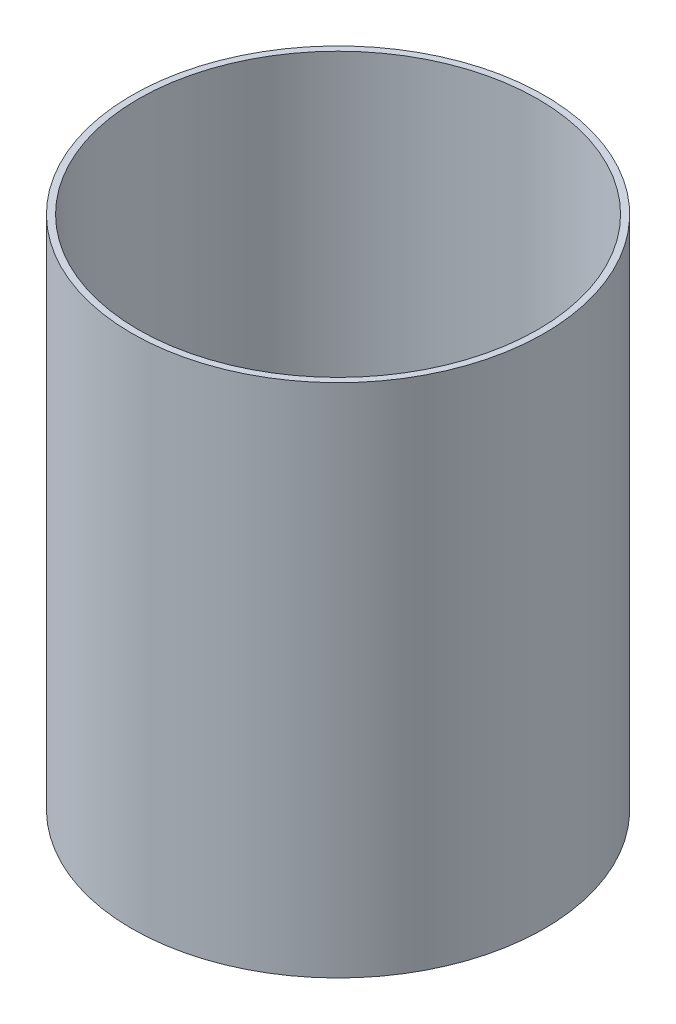
from build123d import *

# Parameters (mm, degrees)
SKETCH1_R           = 101.6
SKETCH1_R_2         = 98.425
BOSS_EXTRUDE1_DEPTH = 127


with BuildPart() as part:
    # Sketch1 → Boss-Extrude1 (new, symmetric)
    with BuildSketch(Plane(origin=(0, 0, 0), x_dir=(1, 0, 0), z_dir=(0, 1, 0))):
        with Locations(Location((0, 0, 0), (0, 0, 270))):
            Circle(SKETCH1_R)
        with Locations(Location((0, 0, 0), (0, 0, 270))):
            Circle(SKETCH1_R_2, mode=Mode.SUBTRACT)
    extrude(amount=BOSS_EXTRUDE1_DEPTH, both=True)


solid = part.part
